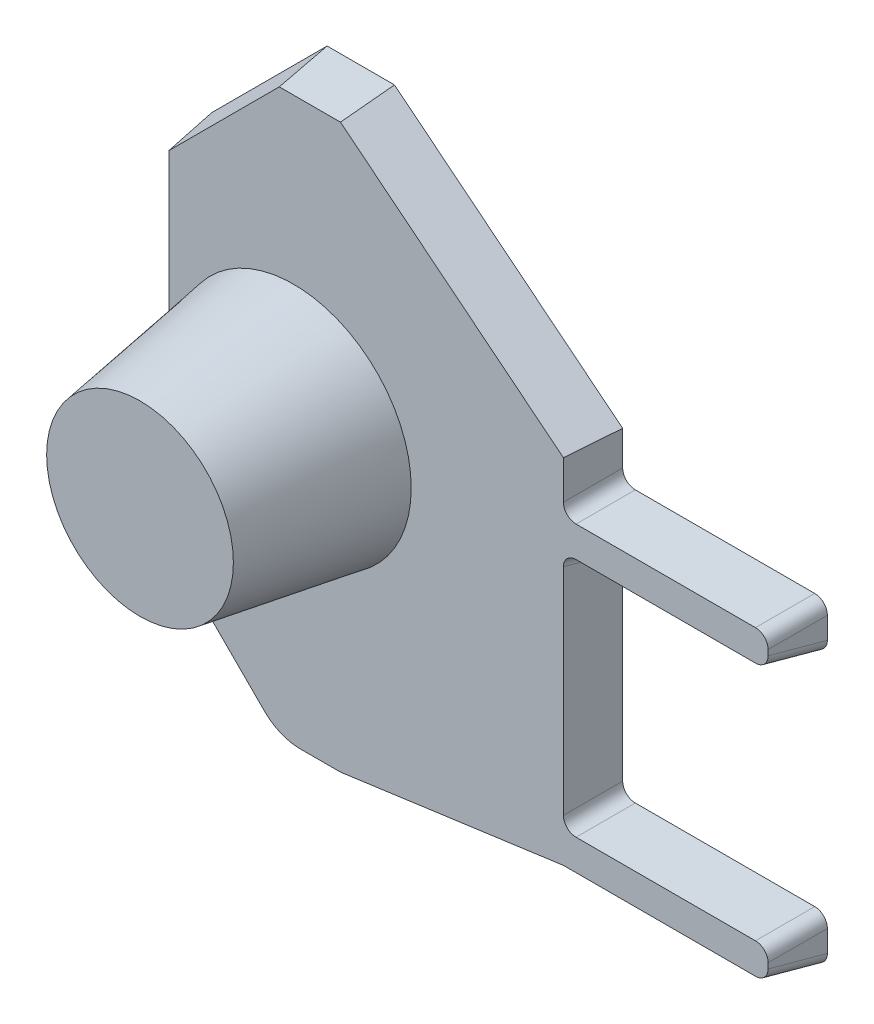
from build123d import *

# Parameters (mm, degrees)
RESSALTO_EXTRUS_O1_DEPTH = 10
RESSALTO_EXTRUS_O1_DRAFT = 9
ESBO_O2_R                = 23
RESSALTO_EXTRUS_O2_DEPTH = 30
RESSALTO_EXTRUS_O2_DRAFT = -9
FILETE1_R                = 10
FILETE2_R                = 2.5
ESCALA1_SCALE            = 1.05
ESBO_O3_R                = 2.5
CORTE_EXTRUS_O1_DEPTH    = 5


with BuildPart() as part:
    # Esboço1 → Ressalto-extrusão1 (with draft: the straight prism first)
    with BuildSketch(Plane.XY):
        Polygon((-22.781745931, 55), (-44.375431078, 33.406314852), (-44.375431078, -33.406314852), (-22.781745931, -55), (-10.825814677, -55), (32.742040246, -49), (72.742040246, -49), (72.742040246, -43), (32.742040246, -43), (32.742040246, 4), (72.742040246, 4), (72.742040246, 10), (32.742040246, 10), (32.742040246, 20), (-10.825814677, 55), align=None)
    extrude(amount=-RESSALTO_EXTRUS_O1_DEPTH)
    # Ressalto-extrusão1: the draft: its side faces are tilted about the plane it starts from
    ressalto_extrus_o1_sides = [part.faces().sort_by_distance(p)[0] for p in [
        (-33.578588504, 44.203157426, -5),
        (-44.375431078, 0, -5),
        (-33.578588504, -44.203157426, -5),
        (-16.803780304, -55, -5),
        (10.958112785, -52, -5),
        (52.742040246, -49, -5),
        (72.742040246, -46, -5),
        (52.742040246, -43, -5),
        (32.742040246, -19.5, -5),
        (52.742040246, 4, -5),
        (72.742040246, 7, -5),
        (52.742040246, 10, -5),
        (32.742040246, 15, -5),
        (10.958112785, 37.5, -5),
        (-16.803780304, 55, -5),
    ]]
    draft(ressalto_extrus_o1_sides, Plane.XY, RESSALTO_EXTRUS_O1_DRAFT)


with BuildPart() as ressalto_extrus_o2_tool:
    # Esboço2 → Ressalto-extrusão2 (with draft: the straight prism first)
    with BuildSketch(Plane(origin=(0, 0, 0), x_dir=(-1, 0, 0), z_dir=(0, 0, -1))):
        with Locations((20, 0)):
            Circle(ESBO_O2_R)
    extrude(amount=-RESSALTO_EXTRUS_O2_DEPTH)
    # Ressalto-extrusão2: the draft: its side faces are tilted about the plane it starts from
    ressalto_extrus_o2_sides = [ressalto_extrus_o2_tool.faces().sort_by_distance(p)[0] for p in [
        (3, 0, 15),
    ]]
    draft(ressalto_extrus_o2_sides, Plane(origin=(0, 0, 0), x_dir=(-1, 0, 0), z_dir=(0, 0, -1)), RESSALTO_EXTRUS_O2_DRAFT)


with BuildPart() as part_1:
    add(part.part)

    # Ressalto-extrusão2: add ressalto_extrus_o2_tool
    add(ressalto_extrus_o2_tool.part)

    # Filete1
    filete1_edges = [part_1.edges().sort_by_distance(p)[0] for p in [
        (-23.109770847, -55.791922202, -5),
    ]]
    fillet(filete1_edges, radius=FILETE1_R)

    # Filete2
    filete2_edges = [part_1.edges().sort_by_distance(p)[0] for p in [
        (33.533962448, 10.791922202, -5),
        (73.533962448, 10.791922202, -5),
        (73.533962448, 3.208077798, -5),
        (33.533962448, 3.208077798, -5),
        (33.533962448, -42.208077798, -5),
        (73.533962448, -42.208077798, -5),
        (73.533962448, -49.791922202, -5),
    ]]
    fillet(filete2_edges, radius=FILETE2_R)


with BuildPart() as part_2:
    # Escala1: scaled about (-8.171649515, -3.224100795, 1.267383115)
    add(part_1.part.scale(ESCALA1_SCALE).moved(Location((0.408582476, 0.16120504, -0.063369156))))

    # Esboço3 → Corte-extrusão1 (cut)
    with BuildSketch(Plane(origin=(0, 0, -10.563369303), x_dir=(-1, 0, 0), z_dir=(0, 0, -1))):
        with Locations((10, 25)):
            Circle(ESBO_O3_R)
        with Locations((10, -25)):
            Circle(ESBO_O3_R)
    extrude(amount=-CORTE_EXTRUS_O1_DEPTH, mode=Mode.SUBTRACT)


solid = part_2.part
